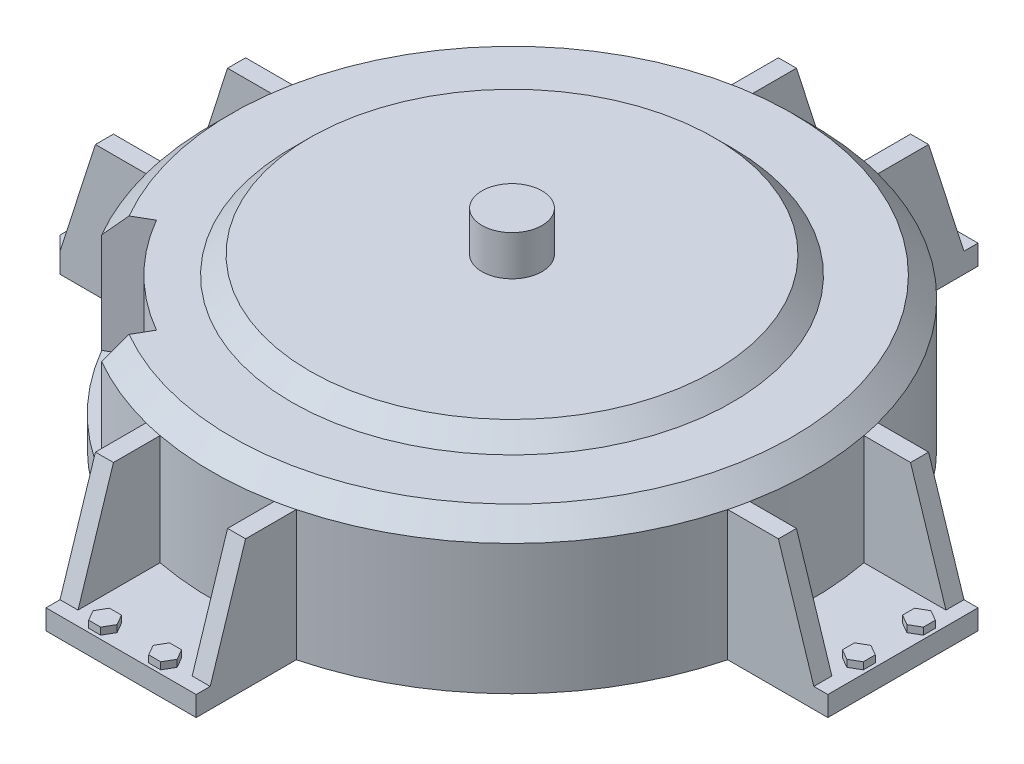
from build123d import *

# Parameters (mm, degrees)
SKETCH1_R                = 150
BOSS_EXTRUDE1_DEPTH      = 75
CHAMFER1_SIZE            = 10
BOSS_EXTRUDE2_START      = -75
BOSS_EXTRUDE2_DEPTH      = 10
CHAMFER2_SIZE            = 7
BOSS_EXTRUDE3_DEPTH      = 9
BOSS_EXTRUDE4_DEPTH      = 3.5
CIRPATTERN1_COUNT        = 4
CIRPATTERN1_COPY_1_DEPTH = 9
CIRPATTERN1_COPY_2_DEPTH = 9
CIRPATTERN1_COPY_3_DEPTH = 9
CIRPATTERN1_COPY_4_DEPTH = 3.5
CIRPATTERN1_COPY_5_DEPTH = 3.5
CIRPATTERN1_COPY_6_DEPTH = 3.5
CUT_EXTRUDE1_START       = -60
CUT_EXTRUDE1_DEPTH       = 60
SKETCH6_R                = 110
BOSS_EXTRUDE5_DEPTH      = 9
BOSS_EXTRUDE5_TAPER      = 45
SKETCH7_R                = 15
BOSS_EXTRUDE6_DEPTH      = 20


with BuildPart() as part:
    # Sketch1 → Boss-Extrude1 (new body)
    with BuildSketch(Plane(origin=(0, 0, 0), x_dir=(1, 0, 0), z_dir=(0, 1, 0))):
        with Locations(Location((0, 0, 0), (0, 0, 270))):
            Circle(SKETCH1_R)
    extrude(amount=BOSS_EXTRUDE1_DEPTH)

    # Chamfer1
    chamfer1_edges = [part.edges().sort_by_distance(p)[0] for p in [
        (0, 75, -150),
    ]]
    chamfer(chamfer1_edges, length=CHAMFER1_SIZE)

    # Sketch2 → Boss-Extrude2 (add)
    with BuildSketch(Plane(origin=(0, 75, 0), x_dir=(1, 0, 0), z_dir=(0, 1, 0)).offset(BOSS_EXTRUDE2_START)):
        with BuildLine():
            Line((-145.236875483, 37.5), (-195.236875483, 37.5))
            Line((-195.236875483, 37.5), (-195.236875483, -37.5))
            Line((-195.236875483, -37.5), (-145.236875483, -37.5))
            ThreePointArc((-145.236875483, -37.5), (-150, 0), (-145.236875483, 37.5))
        make_face()
    boss_extrude2 = extrude(amount=BOSS_EXTRUDE2_DEPTH)

    # Chamfer2
    chamfer2_edges = [part.edges().sort_by_distance(p)[0] for p in [
        (-195.236875483, 5, -37.5),
        (-195.236875483, 5, 37.5),
    ]]
    chamfer(chamfer2_edges, length=CHAMFER2_SIZE)

    # Sketch3 → Boss-Extrude3 (add)
    with BuildSketch(Plane.XY.offset(37.5)):
        Polygon((-145.236875483, 10), (-145.236875483, 65), (-170.556875483, 65), (-188.236875483, 10), align=None)
    boss_extrude3 = extrude(amount=-BOSS_EXTRUDE3_DEPTH)

    # Sketch4 → Boss-Extrude4 (add)
    with BuildSketch(Plane(origin=(0, 10, 0), x_dir=(1, 0, 0), z_dir=(0, 1, 0))):
        Polygon((-183.04072306, -12), (-188.236875483, -9), (-193.433027905, -12), (-193.433027905, -18), (-188.236875483, -21), (-183.04072306, -18), align=None)
    boss_extrude4 = extrude(amount=BOSS_EXTRUDE4_DEPTH)

    # Mirror1: Boss-Extrude3, Boss-Extrude4 across plane
    add(boss_extrude3.mirror(Plane.XY))
    add(boss_extrude4.mirror(Plane.XY))

    # CirPattern1: Boss-Extrude2, Boss-Extrude3, Boss-Extrude4 ×4 about axis
    cirpattern1_axis = Axis((0, 0, 0), (0, 1, 0))
    add([boss_extrude2.rotate(cirpattern1_axis, i * 360 / CIRPATTERN1_COUNT) for i in range(1, CIRPATTERN1_COUNT)])
    add([boss_extrude3.rotate(cirpattern1_axis, i * 360 / CIRPATTERN1_COUNT) for i in range(1, CIRPATTERN1_COUNT)])
    add([boss_extrude4.rotate(cirpattern1_axis, i * 360 / CIRPATTERN1_COUNT) for i in range(1, CIRPATTERN1_COUNT)])

    # CirPattern1 copy 1 sketch → CirPattern1 copy 1 (add)
    with BuildSketch(Plane(origin=(-37.5, 0, 0), x_dir=(0, 0, -1), z_dir=(-1, 0, 0))):
        Polygon((-145.236875483, -10), (-145.236875483, -65), (-170.556875483, -65), (-188.236875483, -10), align=None)
    extrude(amount=-CIRPATTERN1_COPY_1_DEPTH)

    # CirPattern1 copy 2 sketch → CirPattern1 copy 2 (add)
    with BuildSketch(Plane(origin=(0, 0, 37.5), x_dir=(-1, 0, 0), z_dir=(0, 0, 1))):
        Polygon((-145.236875483, -10), (-145.236875483, -65), (-170.556875483, -65), (-188.236875483, -10), align=None)
    extrude(amount=-CIRPATTERN1_COPY_2_DEPTH)

    # CirPattern1 copy 3 sketch → CirPattern1 copy 3 (add)
    with BuildSketch(Plane(origin=(37.5, 0, 0), x_dir=(0, 0, 1), z_dir=(1, 0, 0))):
        Polygon((-145.236875483, -10), (-145.236875483, -65), (-170.556875483, -65), (-188.236875483, -10), align=None)
    extrude(amount=-CIRPATTERN1_COPY_3_DEPTH)

    # CirPattern1 copy 4 sketch → CirPattern1 copy 4 (add)
    with BuildSketch(Plane(origin=(0, 10, 0), x_dir=(0, 0, -1), z_dir=(0, 1, 0))):
        Polygon((-183.04072306, 12), (-188.236875483, 9), (-193.433027905, 12), (-193.433027905, 18), (-188.236875483, 21), (-183.04072306, 18), align=None)
    extrude(amount=CIRPATTERN1_COPY_4_DEPTH)

    # CirPattern1 copy 5 sketch → CirPattern1 copy 5 (add)
    with BuildSketch(Plane(origin=(0, 10, 0), x_dir=(-1, 0, 0), z_dir=(0, 1, 0))):
        Polygon((-183.04072306, 12), (-188.236875483, 9), (-193.433027905, 12), (-193.433027905, 18), (-188.236875483, 21), (-183.04072306, 18), align=None)
    extrude(amount=CIRPATTERN1_COPY_5_DEPTH)

    # CirPattern1 copy 6 sketch → CirPattern1 copy 6 (add)
    with BuildSketch(Plane.ZX.offset(10)):
        Polygon((-183.04072306, 12), (-188.236875483, 9), (-193.433027905, 12), (-193.433027905, 18), (-188.236875483, 21), (-183.04072306, 18), align=None)
    extrude(amount=CIRPATTERN1_COPY_6_DEPTH)

    # Sketch5 → Cut-Extrude1 (cut)
    with BuildSketch(Plane(origin=(0, 75, 0), x_dir=(1, 0, 0), z_dir=(0, 1, 0)).offset(CUT_EXTRUDE1_START)):
        with BuildLine():
            ThreePointArc((-65, -112.583302492), (-91.923881554, -91.923881554), (-112.583302492, -65))
            Line((-112.583302492, -65), (-121.24355653, -70))
            ThreePointArc((-121.24355653, -70), (-98.994949366, -98.994949366), (-70, -121.24355653))
            Line((-70, -121.24355653), (-65, -112.583302492))
        make_face()
        with BuildLine():
            ThreePointArc((-70, -121.24355653), (-98.994949366, -98.994949366), (-121.24355653, -70))
            Line((-121.24355653, -70), (-129.903810568, -75))
            ThreePointArc((-129.903810568, -75), (-106.066017178, -106.066017178), (-75, -129.903810568))
            Line((-75, -129.903810568), (-70, -121.24355653))
        make_face()
    extrude(amount=CUT_EXTRUDE1_DEPTH, mode=Mode.SUBTRACT)

    # Sketch6 → Boss-Extrude5 (add)
    with BuildSketch(Plane(origin=(0, 75, 0), x_dir=(1, 0, 0), z_dir=(0, 1, 0))):
        Circle(SKETCH6_R)
    extrude(amount=BOSS_EXTRUDE5_DEPTH, taper=BOSS_EXTRUDE5_TAPER)

    # Sketch7 → Boss-Extrude6 (add)
    with BuildSketch(Plane(origin=(0, 84, 0), x_dir=(1, 0, 0), z_dir=(0, 1, 0))):
        with Locations(Location((0, 0, 0), (0, 0, 270))):
            Circle(SKETCH7_R)
    extrude(amount=BOSS_EXTRUDE6_DEPTH)


solid = part.part
